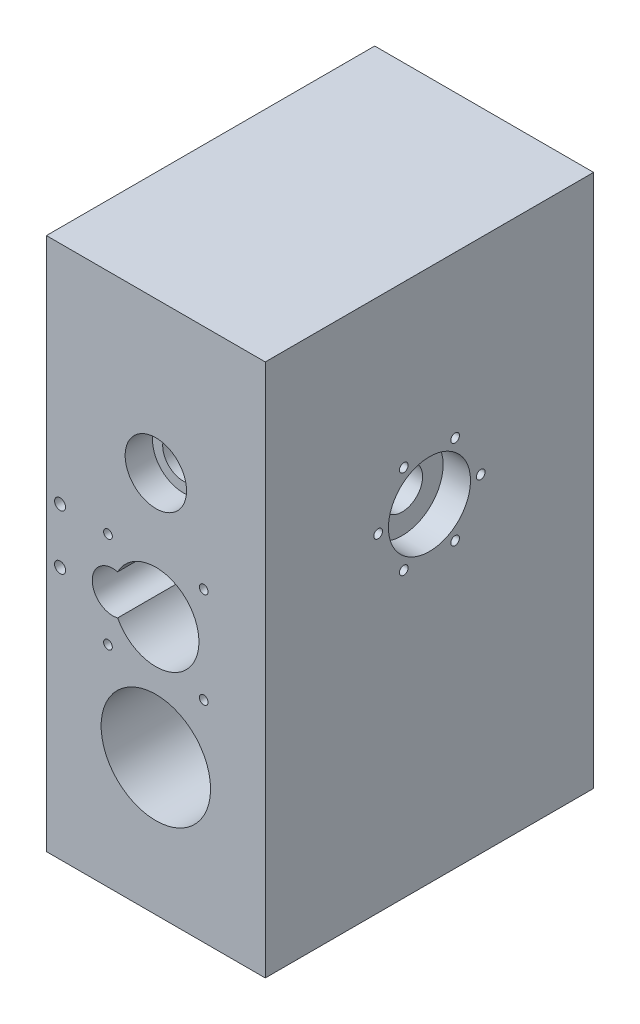
from build123d import *

# Parameters (mm, degrees)
SKETCH1_W                       = 101.6
SKETCH1_H                       = 247.65
BOSS_EXTRUDE1_DEPTH             = 152.4
SKETCH2_R                       = 15.08125
SKETCH2_R_2                     = 9.525
CUT_EXTRUDE1_DEPTH              = 203.827588422
SKETCH33_R                      = 2.5796875
CUT_EXTRUDE33_DEPTH             = 25.4
SKETCH53_R                      = 31.75
CUT_EXTRUDE37_DEPTH             = 24.13
SKETCH54_R                      = 19.05
CUT_EXTRUDE38_DEPTH             = 38.1
SKETCH4_R                       = 19.05
CUT_EXTRUDE40_DEPTH             = 12.7
SKETCH56_R                      = 14.2494
CUT_EXTRUDE42_DEPTH             = 12.7
CUT_EXTRUDE43_START             = -12.7
SKETCH57_R                      = 14.2494
CUT_EXTRUDE43_DEPTH             = 12.7
SKETCH58_R                      = 25.4
CUT_EXTRUDE44_DEPTH             = 50.8
CUT_EXTRUDE45_DEPTH             = 127
FILLET2_R                       = 0.00254
CUT_EXTRUDE46_START             = -12.7
SKETCH60_R                      = 19.05
CUT_EXTRUDE46_DEPTH             = 12.7
SKETCH61_R                      = 9.525
CUT_EXTRUDE47_DEPTH             = 222.090367554
F_10_32_TAPPED_HOLE1_D          = 4.0386
F_10_32_TAPPED_HOLE1_DEPTH      = 25.4
F_10_32_TAPPED_HOLE1_TIP        = 1.213317848
F_10_32_TAPPED_HOLE2_AT_2_COUNT = 2
F_10_32_TAPPED_HOLE2_AT_2_PITCH = 23.8125
F_10_32_TAPPED_HOLE2_AT_3_COUNT = 2
F_10_32_TAPPED_HOLE2_AT_3_PITCH = 23.8125
F_10_32_TAPPED_HOLE2_AT_4_COUNT = 2
F_10_32_TAPPED_HOLE2_AT_4_PITCH = 41.244459855
F_10_32_TAPPED_HOLE2_AT_5_COUNT = 2
F_10_32_TAPPED_HOLE2_AT_5_PITCH = 47.625
F_10_32_TAPPED_HOLE2_AT_6_COUNT = 2
F_10_32_TAPPED_HOLE2_AT_6_PITCH = 41.244459855
F_1_4_20_TAPPED_HOLE1_D         = 5.1054
F_1_4_20_TAPPED_HOLE1_DEPTH     = 19.05
F_1_4_20_TAPPED_HOLE1_TIP       = 1.533816902


with BuildPart() as part:
    # Sketch1 → Boss-Extrude1 (new body)
    with BuildSketch(Plane.XY):
        Rectangle(SKETCH1_W, SKETCH1_H)
    extrude(amount=BOSS_EXTRUDE1_DEPTH)

    # Sketch2 → Cut-Extrude1 (cut, through all)
    with BuildSketch(Plane(origin=(0, 0, 0), x_dir=(-1, 0, 0), z_dir=(0, 0, -1))):
        with Locations((0, -60.579)):
            Circle(SKETCH2_R)
        with Locations((0, 53.721)):
            Circle(SKETCH2_R_2)
    extrude(amount=-CUT_EXTRUDE1_DEPTH, mode=Mode.SUBTRACT)

    # Sketch33 → Cut-Extrude33 (cut)
    with BuildSketch(Plane(origin=(0, 0, 0), x_dir=(-1, 0, 0), z_dir=(0, 0, -1))):
        with Locations((-40.005, 102.9335)):
            Circle(SKETCH33_R)
        with Locations((40.005, 102.9335)):
            Circle(SKETCH33_R)
        with Locations((40.005, 4.5085)):
            Circle(SKETCH33_R)
        with Locations((-40.005, 4.5085)):
            Circle(SKETCH33_R)
    extrude(amount=-CUT_EXTRUDE33_DEPTH, mode=Mode.SUBTRACT)

    # Sketch53 → Cut-Extrude37 (cut)
    with BuildSketch(Plane(origin=(0, 0, 0), x_dir=(-1, 0, 0), z_dir=(0, 0, -1))):
        with Locations((0, -60.579)):
            Circle(SKETCH53_R)
    extrude(amount=-CUT_EXTRUDE37_DEPTH, mode=Mode.SUBTRACT)

    # Sketch54 → Cut-Extrude38 (cut)
    with BuildSketch(Plane(origin=(0, 0, 0), x_dir=(-1, 0, 0), z_dir=(0, 0, -1))):
        with Locations((0, 53.721)):
            Circle(SKETCH54_R)
    extrude(amount=-CUT_EXTRUDE38_DEPTH, mode=Mode.SUBTRACT)

    # Sketch4 → Cut-Extrude40 (cut)
    with BuildSketch(Plane(origin=(50.8, 0, 0), x_dir=(0, 0, -1), z_dir=(1, 0, 0))):
        with Locations((-76.2, 28.575)):
            Circle(SKETCH4_R)
    extrude(amount=-CUT_EXTRUDE40_DEPTH, mode=Mode.SUBTRACT)

    # Sketch56 → Cut-Extrude42 (cut)
    with BuildSketch(Plane.XY.offset(152.4)):
        with Locations((0, 53.721)):
            Circle(SKETCH56_R)
    extrude(amount=-CUT_EXTRUDE42_DEPTH, mode=Mode.SUBTRACT)

    # Sketch57 → Cut-Extrude43 (cut)
    with BuildSketch(Plane(origin=(0, 0, 38.1), x_dir=(-1, 0, 0), z_dir=(0, 0, -1)).offset(CUT_EXTRUDE43_START)):
        with Locations(Location((0, 53.721, 0), (0, 0, 180))):
            Circle(SKETCH57_R)
    extrude(amount=CUT_EXTRUDE43_DEPTH, mode=Mode.SUBTRACT)

    # Sketch58 → Cut-Extrude44 (cut)
    with BuildSketch(Plane.XY.offset(152.4)):
        with Locations((0, -60.579)):
            Circle(SKETCH58_R)
    extrude(amount=-CUT_EXTRUDE44_DEPTH, mode=Mode.SUBTRACT)

    # Sketch59 → Cut-Extrude45 (cut)
    with BuildSketch(Plane.XY.offset(152.4)):
        with BuildLine():
            ThreePointArc((-17.734642857, -13.34047826), (20.0025, -4.0894), (-17.734642857, 5.16167826))
            ThreePointArc((-17.734642857, 5.16167826), (-29.5275, -4.0894), (-17.734642857, -13.34047826))
        make_face()
    extrude(amount=-CUT_EXTRUDE45_DEPTH, mode=Mode.SUBTRACT)

    # Fillet2
    fillet2_edges = [part.edges().sort_by_distance(p)[0] for p in [
        (50.8, -123.825, 76.2),
        (-50.8, -123.825, 76.2),
        (-50.8, 123.825, 76.2),
        (50.8, 123.825, 76.2),
    ]]
    fillet(fillet2_edges, radius=FILLET2_R)

    # Sketch60 → Cut-Extrude46 (cut)
    with BuildSketch(Plane.ZY.offset(50.8).offset(CUT_EXTRUDE46_START)):
        with Locations(Location((76.2, 28.575, 0), (0, 0, 180))):
            Circle(SKETCH60_R)
    extrude(amount=CUT_EXTRUDE46_DEPTH, mode=Mode.SUBTRACT)

    # Sketch61 → Cut-Extrude47 (cut, through all)
    with BuildSketch(Plane(origin=(50.8, 0, 0), x_dir=(0, 0, -1), z_dir=(1, 0, 0))):
        with Locations((-76.2, 28.575)):
            Circle(SKETCH61_R)
    extrude(amount=-CUT_EXTRUDE47_DEPTH, mode=Mode.SUBTRACT)

    # #10-32 Tapped Hole1
    with Locations(Plane.XY.offset(152.4)):
        with Locations((-22.225, 18.1356), (22.225, 18.1356), (22.225, -26.3144), (-22.225, -26.3144)):
            Hole(F_10_32_TAPPED_HOLE1_D / 2, depth=F_10_32_TAPPED_HOLE1_DEPTH)
            with Locations((0, 0, -(F_10_32_TAPPED_HOLE1_DEPTH + F_10_32_TAPPED_HOLE1_TIP / 2))):  # 118° drill point
                Cone(0, F_10_32_TAPPED_HOLE1_D / 2, F_10_32_TAPPED_HOLE1_TIP, mode=Mode.SUBTRACT)

    # Sketch66 → #10-32 Tapped Hole2 (revolve, cut)
    with BuildSketch(Plane(origin=(-50.8, 7.952770072, 64.29375), x_dir=(0, 0, 1), z_dir=(0, 1, 0))):
        Polygon((0, 0), (0, 26.613317848), (2.0193, 25.4), (2.0193, 0), align=None)
    f_10_32_tapped_hole2 = revolve(axis=Axis((-57.15, 7.952770072, 64.29375), (1, 0, 0)), mode=Mode.SUBTRACT)

    # #10-32 Tapped Hole2 at 2: #10-32 Tapped Hole2 ×2
    with Locations(*[Vector(0, 0.8660254037844412, -0.4999999999999957) * (i * F_10_32_TAPPED_HOLE2_AT_2_PITCH) for i in range(1, F_10_32_TAPPED_HOLE2_AT_2_COUNT)]):
        add(f_10_32_tapped_hole2, mode=Mode.SUBTRACT)

    # #10-32 Tapped Hole2 at 3: #10-32 Tapped Hole2 ×2
    with Locations(*[(0, 0, i * F_10_32_TAPPED_HOLE2_AT_3_PITCH) for i in range(1, F_10_32_TAPPED_HOLE2_AT_3_COUNT)]):
        add(f_10_32_tapped_hole2, mode=Mode.SUBTRACT)

    # #10-32 Tapped Hole2 at 4: #10-32 Tapped Hole2 ×2
    with Locations(*[Vector(0, 0.49999999999999195, 0.8660254037844434) * (i * F_10_32_TAPPED_HOLE2_AT_4_PITCH) for i in range(1, F_10_32_TAPPED_HOLE2_AT_4_COUNT)]):
        add(f_10_32_tapped_hole2, mode=Mode.SUBTRACT)

    # #10-32 Tapped Hole2 at 5: #10-32 Tapped Hole2 ×2
    with Locations(*[Vector(0, 0.8660254037844348, 0.5000000000000068) * (i * F_10_32_TAPPED_HOLE2_AT_5_PITCH) for i in range(1, F_10_32_TAPPED_HOLE2_AT_5_COUNT)]):
        add(f_10_32_tapped_hole2, mode=Mode.SUBTRACT)

    # #10-32 Tapped Hole2 at 6: #10-32 Tapped Hole2 ×2
    with Locations(*[(0, i * F_10_32_TAPPED_HOLE2_AT_6_PITCH, 0) for i in range(1, F_10_32_TAPPED_HOLE2_AT_6_COUNT)]):
        add(f_10_32_tapped_hole2, mode=Mode.SUBTRACT)

    # Mirror1: #10-32 Tapped Hole2 across plane
    add(f_10_32_tapped_hole2.mirror(Plane(origin=(0, 0, 0), x_dir=(0, 0, 1), z_dir=(1, 0, 0))), mode=Mode.SUBTRACT)

    # Mirror1 copy 1 sketch → Mirror1 copy 1 (revolve, cut)
    with BuildSketch(Plane(origin=(50.8, 28.575, 52.3875), x_dir=(0, 0, 1), z_dir=(0, 1, 0))):
        Polygon((0, 0), (0, -26.613317848), (2.0193, -25.4), (2.0193, 0), align=None)
    revolve(axis=Axis((57.15, 28.575, 52.3875), (1, 0, 0)), mode=Mode.SUBTRACT)

    # Mirror1 copy 2 sketch → Mirror1 copy 2 (revolve, cut)
    with BuildSketch(Plane(origin=(50.8, 7.952770072, 88.10625), x_dir=(0, 0, 1), z_dir=(0, 1, 0))):
        Polygon((0, 0), (0, -26.613317848), (2.0193, -25.4), (2.0193, 0), align=None)
    revolve(axis=Axis((57.15, 7.952770072, 88.10625), (1, 0, 0)), mode=Mode.SUBTRACT)

    # Mirror1 copy 3 sketch → Mirror1 copy 3 (revolve, cut)
    with BuildSketch(Plane(origin=(50.8, 28.575, 100.0125), x_dir=(0, 0, 1), z_dir=(0, 1, 0))):
        Polygon((0, 0), (0, -26.613317848), (2.0193, -25.4), (2.0193, 0), align=None)
    revolve(axis=Axis((57.15, 28.575, 100.0125), (1, 0, 0)), mode=Mode.SUBTRACT)

    # Mirror1 copy 4 sketch → Mirror1 copy 4 (revolve, cut)
    with BuildSketch(Plane(origin=(50.8, 49.197229928, 88.10625), x_dir=(0, 0, 1), z_dir=(0, 1, 0))):
        Polygon((0, 0), (0, -26.613317848), (2.0193, -25.4), (2.0193, 0), align=None)
    revolve(axis=Axis((57.15, 49.197229928, 88.10625), (1, 0, 0)), mode=Mode.SUBTRACT)

    # Mirror1 copy 5 sketch → Mirror1 copy 5 (revolve, cut)
    with BuildSketch(Plane(origin=(50.8, 49.197229928, 64.29375), x_dir=(0, 0, 1), z_dir=(0, 1, 0))):
        Polygon((0, 0), (0, -26.613317848), (2.0193, -25.4), (2.0193, 0), align=None)
    revolve(axis=Axis((57.15, 49.197229928, 64.29375), (1, 0, 0)), mode=Mode.SUBTRACT)

    # 1/4-20 Tapped Hole1
    with Locations(Plane.XY.offset(152.4)):
        with Locations((-44.45, 19.05), (-44.45, -6.35)):
            Hole(F_1_4_20_TAPPED_HOLE1_D / 2, depth=F_1_4_20_TAPPED_HOLE1_DEPTH)
            with Locations((0, 0, -(F_1_4_20_TAPPED_HOLE1_DEPTH + F_1_4_20_TAPPED_HOLE1_TIP / 2))):  # 118° drill point
                Cone(0, F_1_4_20_TAPPED_HOLE1_D / 2, F_1_4_20_TAPPED_HOLE1_TIP, mode=Mode.SUBTRACT)


solid = part.part
